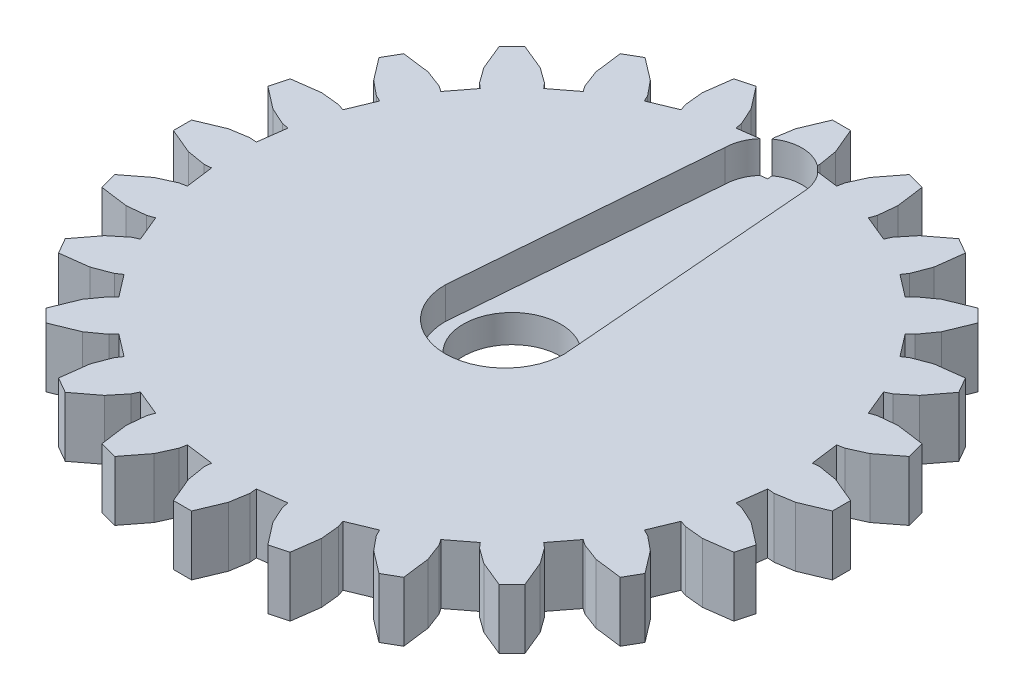
from build123d import *

# Parameters (mm, degrees)
SKETCH1_R           = 2.45
BOSS_EXTRUDE1_DEPTH = 3
CUT_EXTRUDE1_DEPTH  = 1.6


with BuildPart() as part:
    # Sketch1 → Boss-Extrude1 (new body)
    with BuildSketch(Plane(origin=(0, 0, 0), x_dir=(1, 0, 0), z_dir=(0, 1, 0))):
        Polygon((13.971400219, 1.464735526), (14.322080219, 1.492975526), (15.257120219, 1.339825526), (16.556810219, 0.796015526), (16.556810219, -0.114944474), (15.257120219, -0.658754474), (14.322080219, -0.811904474), (13.971400219, -0.783664474), (13.786680219, -2.186794474), (14.132710219, -2.250284474), (14.996260219, -2.640224474), (16.110910219, -3.501884474), (15.875130219, -4.381804474), (14.478990219, -4.570694474), (13.536170219, -4.476624474), (13.204750219, -4.358584474), (12.663160219, -5.666094474), (12.980970219, -5.816984474), (13.714170219, -6.417134474), (14.567820219, -7.537934474), (14.112340219, -8.326844474), (12.714880219, -8.147954474), (11.828530219, -7.813064474), (11.538960219, -7.613274474), (10.677410219, -8.736054474), (10.945350219, -8.964054474), (11.498230219, -9.733524474), (12.032710219, -11.037074474), (11.388570219, -11.681214474), (10.085020219, -11.146734474), (9.315550219, -10.593854474), (9.087550219, -10.325914474), (7.964770219, -11.187464474), (8.164560219, -11.477034474), (8.499450219, -12.363384474), (8.678340219, -13.760844474), (7.889430219, -14.216324474), (6.768630219, -13.362674474), (6.168480219, -12.629474474), (6.017590219, -12.311664474), (4.710080219, -12.853254474), (4.828120219, -13.184674474), (4.922190219, -14.127494474), (4.733300219, -15.523634474), (3.853380219, -15.759414474), (2.991720219, -14.644764474), (2.601780219, -13.781214474), (2.538290219, -13.435184474), (1.135160219, -13.619904474), (1.163400219, -13.970584474), (1.010250219, -14.905624474), (0.466440219, -16.205314474), (-0.444519781, -16.205314474), (-0.988329781, -14.905624474), (-1.141479781, -13.970584474), (-1.113239781, -13.619904474), (-2.516369781, -13.435184474), (-2.579859781, -13.781214474), (-2.969799781, -14.644764474), (-3.831459781, -15.759414474), (-4.711379781, -15.523634474), (-4.900269781, -14.127494474), (-4.806199781, -13.184674474), (-4.688159781, -12.853254474), (-5.995669781, -12.311664474), (-6.146559781, -12.629474474), (-6.746709781, -13.362674474), (-7.867509781, -14.216324474), (-8.656419781, -13.760844474), (-8.477529781, -12.363384474), (-8.142639781, -11.477034474), (-7.942849781, -11.187464474), (-9.065629781, -10.325914474), (-9.293629781, -10.593854474), (-10.063099781, -11.146734474), (-11.366649781, -11.681214474), (-12.010789781, -11.037074474), (-11.476309781, -9.733524474), (-10.923429781, -8.964054474), (-10.655489781, -8.736054474), (-11.517039781, -7.613274474), (-11.806609781, -7.813064474), (-12.692959781, -8.147954474), (-14.090419781, -8.326844474), (-14.545899781, -7.537934474), (-13.692249781, -6.417134474), (-12.959049781, -5.816984474), (-12.641239781, -5.666094474), (-13.182829781, -4.358584474), (-13.514249781, -4.476624474), (-14.457069781, -4.570694474), (-15.853209781, -4.381804474), (-16.088989781, -3.501884474), (-14.974339781, -2.640224474), (-14.110789781, -2.250284474), (-13.764759781, -2.186794474), (-13.949479781, -0.783664474), (-14.300159781, -0.811904474), (-15.235199781, -0.658754474), (-16.534889781, -0.114944474), (-16.534889781, 0.796015526), (-15.235199781, 1.339825526), (-14.300159781, 1.492975526), (-13.949479781, 1.464735526), (-13.764759781, 2.867865526), (-14.110789781, 2.931355526), (-14.974339781, 3.321295526), (-16.088989781, 4.182955526), (-15.853209781, 5.062875526), (-14.457069781, 5.251765526), (-13.514249781, 5.157695526), (-13.182829781, 5.039655526), (-12.641239781, 6.347165526), (-12.959049781, 6.498055526), (-13.692249781, 7.098205526), (-14.545899781, 8.219005526), (-14.090419781, 9.007915526), (-12.692959781, 8.829025526), (-11.806609781, 8.494135526), (-11.517039781, 8.294345526), (-10.655489781, 9.417125526), (-10.923429781, 9.645125526), (-11.476309781, 10.414595526), (-12.010789781, 11.718145526), (-11.366649781, 12.362285526), (-10.063099781, 11.827805526), (-9.293629781, 11.274925526), (-9.065629781, 11.006985526), (-7.942849781, 11.868535526), (-8.142639781, 12.158105526), (-8.477529781, 13.044455526), (-8.656419781, 14.441915526), (-7.867509781, 14.897395526), (-6.746709781, 14.043745526), (-6.146559781, 13.310545526), (-5.995669781, 12.992735526), (-4.688159781, 13.534325526), (-4.806199781, 13.865745526), (-4.900269781, 14.808565526), (-4.711379781, 16.204705526), (-3.831459781, 16.440485526), (-2.969799781, 15.325835526), (-2.579859781, 14.462285526), (-2.516369781, 14.116255526), (-1.113239781, 14.300975526), (-1.141479781, 14.651655526), (-0.988329781, 15.586695526), (-0.444519781, 16.886385526), (0.466440219, 16.886385526), (1.010250219, 15.586695526), (1.163400219, 14.651655526), (1.135160219, 14.300975526), (2.538290219, 14.116255526), (2.601780219, 14.462285526), (2.991720219, 15.325835526), (3.853380219, 16.440485526), (4.733300219, 16.204705526), (4.922190219, 14.808565526), (4.828120219, 13.865745526), (4.710080219, 13.534325526), (6.017590219, 12.992735526), (6.168480219, 13.310545526), (6.768630219, 14.043745526), (7.889430219, 14.897395526), (8.678340219, 14.441915526), (8.499450219, 13.044455526), (8.164560219, 12.158105526), (7.964770219, 11.868535526), (9.087550219, 11.006985526), (9.315550219, 11.274925526), (10.085020219, 11.827805526), (11.388570219, 12.362285526), (12.032710219, 11.718145526), (11.498230219, 10.414595526), (10.945350219, 9.645125526), (10.677410219, 9.417125526), (11.538960219, 8.294345526), (11.828530219, 8.494135526), (12.714880219, 8.829025526), (14.112340219, 9.007915526), (14.567820219, 8.219005526), (13.714170219, 7.098205526), (12.980970219, 6.498055526), (12.663160219, 6.347165526), (13.204750219, 5.039655526), (13.536170219, 5.157695526), (14.478990219, 5.251765526), (15.875130219, 5.062875526), (16.110910219, 4.182955526), (14.996260219, 3.321295526), (14.132710219, 2.931355526), (13.786680219, 2.867865526), align=None)
        with Locations(Location((0.010960219, 0.340535526, 0), (0, 0, 270))):
            Circle(SKETCH1_R, mode=Mode.SUBTRACT)
    extrude(amount=BOSS_EXTRUDE1_DEPTH)

    # Sketch2 → Cut-Extrude1 (cut)
    with BuildSketch(Plane(origin=(0, 3, 0), x_dir=(1, 0, 0), z_dir=(0, 1, 0))):
        with BuildLine():
            Line((-3, 0), (-1.95, 13))
            ThreePointArc((-1.95, 13), (0, 14.908890964), (1.95, 13))
            Line((1.95, 13), (3, 0))
            ThreePointArc((3, 0), (0, -3), (-3, 0))
        make_face()
    extrude(amount=-CUT_EXTRUDE1_DEPTH, mode=Mode.SUBTRACT)


solid = part.part
